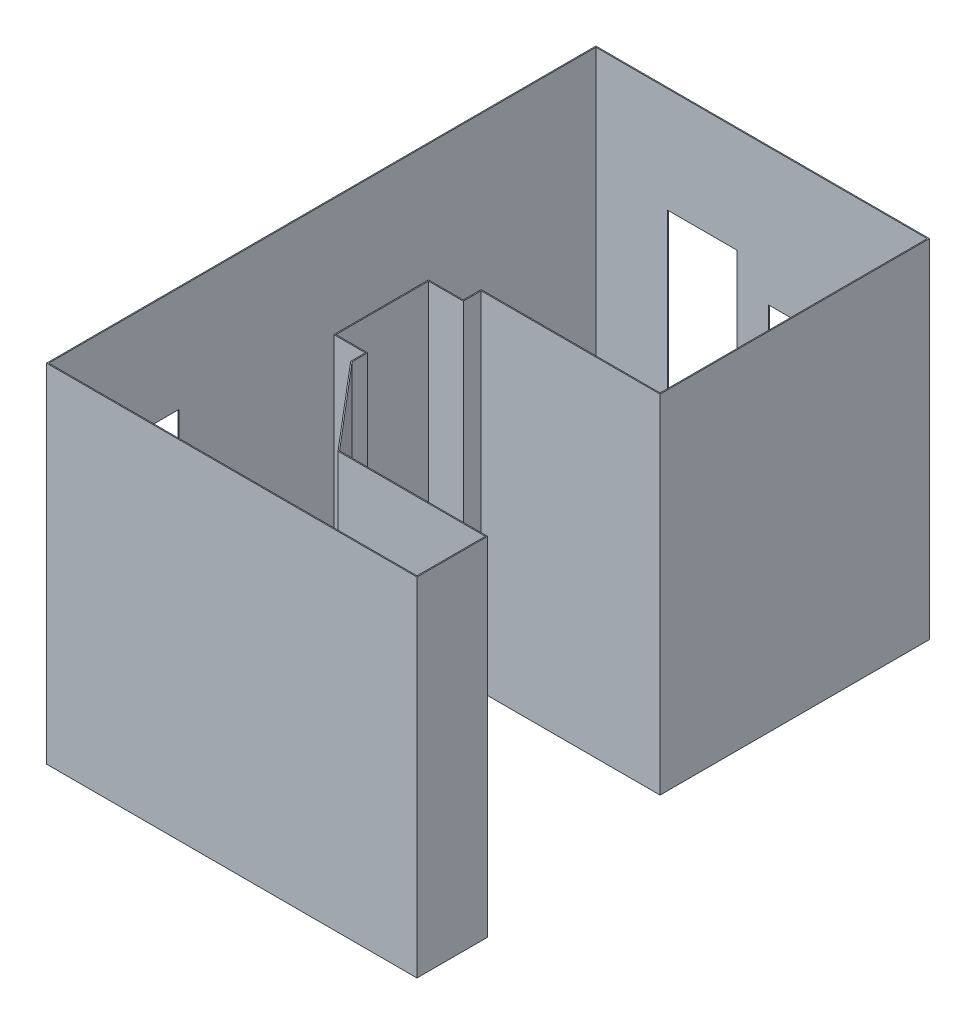
from build123d import *

# Parameters (mm, degrees)
EXTRUDE_2_DEPTH     = 330
SKETCH_2_W          = 66
SKETCH_2_H          = 220
SKETCH_2_W_2        = 145
SKETCH_2_H_2        = 100
CUT_EXTRUDE_1_DEPTH = 10
SKETCH_5_W          = 82
SKETCH_5_H          = 220
CUT_EXTRUDE_3_DEPTH = 10
SKETCH_9_W          = 65
SKETCH_9_H          = 220
CUT_EXTRUDE_5_DEPTH = 10


with BuildPart() as part:
    # Эскиз1 → Вытянуть-Тонкостенный2 (new body)
    with BuildSketch(Plane(origin=(0, 0, 0), x_dir=(1, 0, 0), z_dir=(0, 1, 0))):
        Polygon((-34.007352544, 521), (-351, 521), (-351, -1), (1, -1), (1, 66), (-139.537591907, 66), (-207.007352544, 145.367607311), (-207.007352544, 160), (-237.007352544, 160), (-237.007352544, 248), (-204.007352544, 248), (-204.007352544, 265), (-34.007352544, 265), align=None)
        Polygon((-35.007352544, 520), (-350, 520), (-350, 0), (0, 0), (0, 65), (-140, 65), (-208.007352544, 145), (-208.007352544, 159), (-238.007352544, 159), (-238.007352544, 249), (-205.007352544, 249), (-205.007352544, 266), (-35.007352544, 266), align=None, mode=Mode.SUBTRACT)
    extrude(amount=EXTRUDE_2_DEPTH)

    # Эскиз2 → Вырез-Вытянуть1 (cut)
    with BuildSketch(Plane(origin=(0, 0, -521), x_dir=(-1, 0, 0), z_dir=(0, 0, -1))):
        with Locations((249, 120)):
            Rectangle(SKETCH_2_W, SKETCH_2_H)
        with Locations((113.5, 150)):
            Rectangle(SKETCH_2_W_2, SKETCH_2_H_2)
    extrude(amount=-CUT_EXTRUDE_1_DEPTH, mode=Mode.SUBTRACT)

    # Эскиз5 → Вырез-Вытянуть3 (cut)
    with BuildSketch(Plane.ZY.offset(351)):
        with Locations((-83, 120)):
            Rectangle(SKETCH_5_W, SKETCH_5_H)
    extrude(amount=-CUT_EXTRUDE_3_DEPTH, mode=Mode.SUBTRACT)

    # Эскиз9 → Вырез-Вытянуть5 (cut)
    with BuildSketch(Plane(origin=(-49.193811045, 0, 41.819260634), x_dir=(0.6476890718445449, 0, 0.7619047619047621), z_dir=(-0.7619047619047621, 0, 0.6476890718445449))):
        with Locations((-202.700279582, 120)):
            Rectangle(SKETCH_9_W, SKETCH_9_H)
    extrude(amount=-CUT_EXTRUDE_5_DEPTH, mode=Mode.SUBTRACT)


solid = part.part
